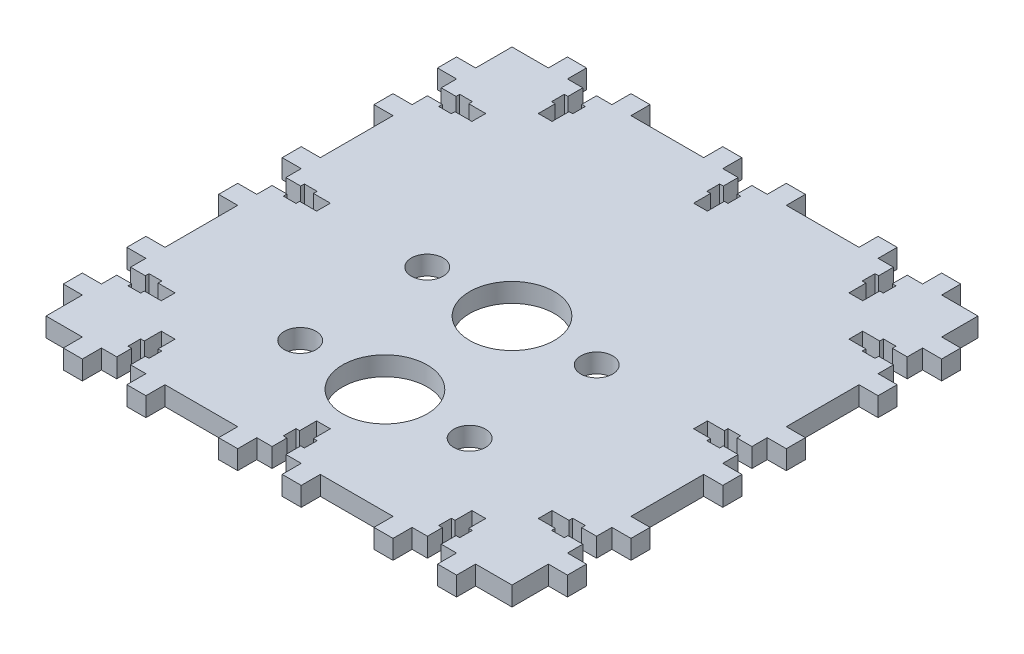
from build123d import *

# Parameters (mm, degrees)
SKETCH1_R           = 7.5
SKETCH1_R_2         = 20
BOSS_EXTRUDE1_DEPTH = 9


with BuildPart() as part:
    # Sketch1 → Boss-Extrude1 (new body)
    with BuildSketch(Plane(origin=(0, 0, 0), x_dir=(1, 0, 0), z_dir=(0, 1, 0))):
        Polygon((-110, -110), (-92.833333333, -110), (-92.833333333, -119), (-83.833333333, -119), (-83.833333333, -110), (-76.583333333, -110), (-76.583333333, -103), (-78.308333333, -103), (-78.308333333, -97), (-76.583333333, -97), (-76.583333333, -89), (-70.083333333, -89), (-70.083333333, -97), (-68.358333333, -97), (-68.358333333, -103), (-70.083333333, -103), (-70.083333333, -110), (-62.833333333, -110), (-62.833333333, -119), (-53.833333333, -119), (-53.833333333, -110), (-19.5, -110), (-19.5, -119), (-10.5, -119), (-10.5, -110), (-3.25, -110), (-3.25, -103), (-4.975, -103), (-4.975, -97), (-3.25, -97), (-3.25, -89), (3.25, -89), (3.25, -97), (4.975, -97), (4.975, -103), (3.25, -103), (3.25, -110), (10.5, -110), (10.5, -119), (19.5, -119), (19.5, -110), (53.833333333, -110), (53.833333333, -119), (62.833333333, -119), (62.833333333, -110), (70.083333333, -110), (70.083333333, -103), (68.358333333, -103), (68.358333333, -97), (70.083333333, -97), (70.083333333, -89), (76.583333333, -89), (76.583333333, -97), (78.308333333, -97), (78.308333333, -103), (76.583333333, -103), (76.583333333, -110), (83.833333333, -110), (83.833333333, -119), (92.833333333, -119), (92.833333333, -110), (110, -110), (110, -92.833333333), (119, -92.833333333), (119, -83.833333333), (110, -83.833333333), (110, -76.583333333), (103, -76.583333333), (103, -78.308333333), (97, -78.308333333), (97, -76.583333333), (89, -76.583333333), (89, -70.083333333), (97, -70.083333333), (97, -68.358333333), (103, -68.358333333), (103, -70.083333333), (110, -70.083333333), (110, -62.833333333), (119, -62.833333333), (119, -53.833333333), (110, -53.833333333), (110, -19.5), (119, -19.5), (119, -10.5), (110, -10.5), (110, -3.25), (103, -3.25), (103, -4.975), (97, -4.975), (97, -3.25), (89, -3.25), (89, 3.25), (97, 3.25), (97, 4.975), (103, 4.975), (103, 3.25), (110, 3.25), (110, 10.5), (119, 10.5), (119, 19.5), (110, 19.5), (110, 53.833333333), (119, 53.833333333), (119, 62.833333333), (110, 62.833333333), (110, 70.083333333), (103, 70.083333333), (103, 68.358333333), (97, 68.358333333), (97, 70.083333333), (89, 70.083333333), (89, 76.583333333), (97, 76.583333333), (97, 78.308333333), (103, 78.308333333), (103, 76.583333333), (110, 76.583333333), (110, 83.833333333), (119, 83.833333333), (119, 92.833333333), (110, 92.833333333), (110, 110), (92.833333333, 110), (92.833333333, 119), (83.833333333, 119), (83.833333333, 110), (76.583333333, 110), (76.583333333, 103), (78.308333333, 103), (78.308333333, 97), (76.583333333, 97), (76.583333333, 89), (70.083333333, 89), (70.083333333, 97), (68.358333333, 97), (68.358333333, 103), (70.083333333, 103), (70.083333333, 110), (62.833333333, 110), (62.833333333, 119), (53.833333333, 119), (53.833333333, 110), (19.5, 110), (19.5, 119), (10.5, 119), (10.5, 110), (3.25, 110), (3.25, 103), (4.975, 103), (4.975, 97), (3.25, 97), (3.25, 89), (-3.25, 89), (-3.25, 97), (-4.975, 97), (-4.975, 103), (-3.25, 103), (-3.25, 110), (-10.5, 110), (-10.5, 119), (-19.5, 119), (-19.5, 110), (-53.833333333, 110), (-53.833333333, 119), (-62.833333333, 119), (-62.833333333, 110), (-70.083333333, 110), (-70.083333333, 103), (-68.358333333, 103), (-68.358333333, 97), (-70.083333333, 97), (-70.083333333, 89), (-76.583333333, 89), (-76.583333333, 97), (-78.308333333, 97), (-78.308333333, 103), (-76.583333333, 103), (-76.583333333, 110), (-83.833333333, 110), (-83.833333333, 119), (-92.833333333, 119), (-92.833333333, 110), (-110, 110), (-110, 92.833333333), (-119, 92.833333333), (-119, 83.833333333), (-110, 83.833333333), (-110, 76.583333333), (-103, 76.583333333), (-103, 78.308333333), (-97, 78.308333333), (-97, 76.583333333), (-89, 76.583333333), (-89, 70.083333333), (-97, 70.083333333), (-97, 68.358333333), (-103, 68.358333333), (-103, 70.083333333), (-110, 70.083333333), (-110, 62.833333333), (-119, 62.833333333), (-119, 53.833333333), (-110, 53.833333333), (-110, 19.5), (-119, 19.5), (-119, 10.5), (-110, 10.5), (-110, 3.25), (-103, 3.25), (-103, 4.975), (-97, 4.975), (-97, 3.25), (-89, 3.25), (-89, -3.25), (-97, -3.25), (-97, -4.975), (-103, -4.975), (-103, -3.25), (-110, -3.25), (-110, -10.5), (-119, -10.5), (-119, -19.5), (-110, -19.5), (-110, -53.833333333), (-119, -53.833333333), (-119, -62.833333333), (-110, -62.833333333), (-110, -70.083333333), (-103, -70.083333333), (-103, -68.358333333), (-97, -68.358333333), (-97, -70.083333333), (-89, -70.083333333), (-89, -76.583333333), (-97, -76.583333333), (-97, -78.308333333), (-103, -78.308333333), (-103, -76.583333333), (-110, -76.583333333), (-110, -83.833333333), (-119, -83.833333333), (-119, -92.833333333), (-110, -92.833333333), align=None)
        with Locations(Location((-40, -60, 0), (0, 0, 270))):
            Circle(SKETCH1_R, mode=Mode.SUBTRACT)
        with Locations(Location((0, -60, 0), (0, 0, 270))):
            Circle(SKETCH1_R_2, mode=Mode.SUBTRACT)
        with Locations(Location((-40, 0, 0), (0, 0, 270))):
            Circle(SKETCH1_R, mode=Mode.SUBTRACT)
        with Locations(Location((0, 0, 0), (0, 0, 270))):
            Circle(SKETCH1_R_2, mode=Mode.SUBTRACT)
        with Locations(Location((40, -60, 0), (0, 0, 270))):
            Circle(SKETCH1_R, mode=Mode.SUBTRACT)
        with Locations(Location((40, 0, 0), (0, 0, 270))):
            Circle(SKETCH1_R, mode=Mode.SUBTRACT)
    extrude(amount=BOSS_EXTRUDE1_DEPTH)


solid = part.part
